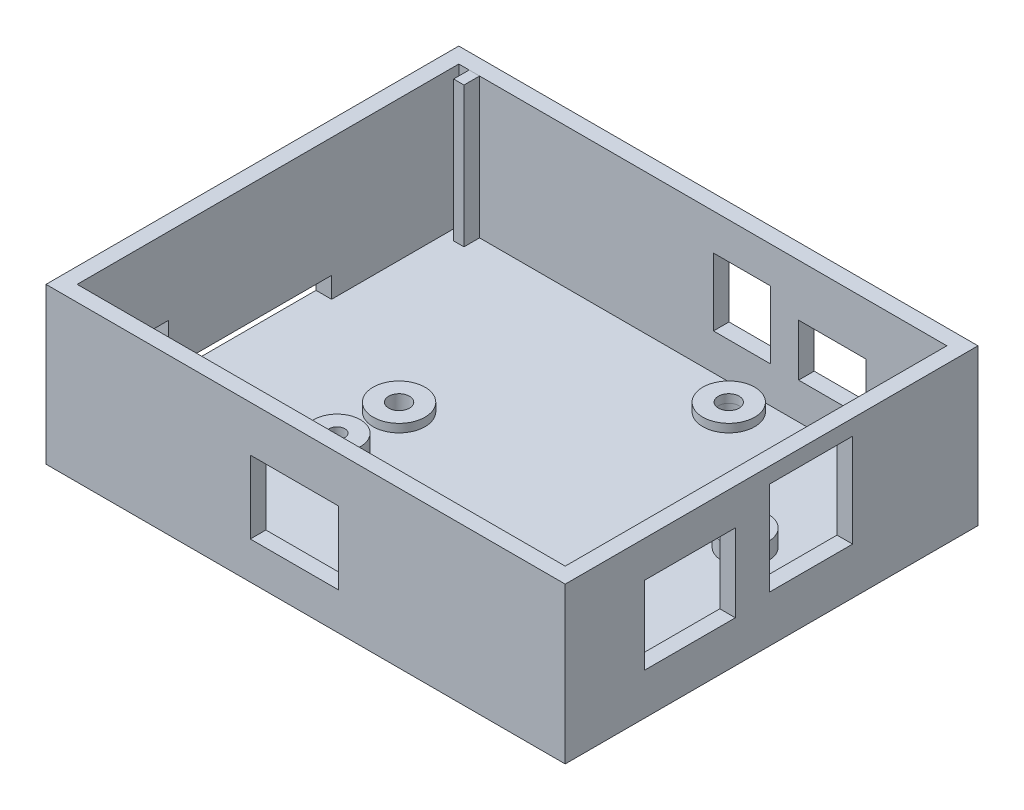
from build123d import *

# Parameters (mm, degrees)
SKETCH4_W             = 100
SKETCH4_H             = 79.5
BOSS_EXTRUDE3_DEPTH   = 30
SKETCH5_W             = 94
SKETCH5_H             = 73.5
CUT_EXTRUDE1_DEPTH    = 27
SKETCH9_R             = 5
BOSS_EXTRUDE5_DEPTH   = 1.6
BOSS_EXTRUDE5_2_DEPTH = 1.6
SKETCH10_R            = 2
CUT_EXTRUDE2_DEPTH    = 131.251333966
SKETCH11_R            = 2
CUT_EXTRUDE3_DEPTH    = 131.251333966
SKETCH12_R            = 4.5
BOSS_EXTRUDE6_DEPTH   = 3.2
SKETCH13_R            = 1.5
CUT_EXTRUDE4_DEPTH    = 130.948797609
SKETCH14_R            = 1.5
CUT_EXTRUDE5_DEPTH    = 130.948797609
SKETCH15_W            = 2
SKETCH15_H            = 3
BOSS_EXTRUDE7_DEPTH   = 27
SKETCH17_W            = 28
SKETCH17_H            = 4
CUT_EXTRUDE8_DEPTH    = 22.2
SKETCH18_W            = 8
SKETCH18_H            = 8
CUT_EXTRUDE9_DEPTH    = 22.2
SKETCH19_W            = 17
SKETCH19_H            = 14
CUT_EXTRUDE11_DEPTH   = 22.2
SKETCH20_R            = 5
BOSS_EXTRUDE8_DEPTH   = 1.6
SKETCH21_R            = 2
CUT_EXTRUDE12_DEPTH   = 131.251333966
SKETCH23_W            = 13
SKETCH23_H            = 10
SKETCH23_W_2          = 11
SKETCH23_H_2          = 13
CUT_EXTRUDE13_DEPTH   = 130.430483272
SKETCH24_W            = 16
SKETCH24_H            = 18
SKETCH24_W_2          = 17.520597446
SKETCH24_H_2          = 15
CUT_EXTRUDE15_DEPTH   = 129.954449322


with BuildPart() as part:
    # Sketch4 → Boss-Extrude3 (new body)
    with BuildSketch(Plane(origin=(0, 0, 0), x_dir=(1, 0, 0), z_dir=(0, 1, 0))):
        with Locations((50, 39.75)):
            Rectangle(SKETCH4_W, SKETCH4_H)
    extrude(amount=BOSS_EXTRUDE3_DEPTH)

    # Sketch5 → Cut-Extrude1 (cut)
    with BuildSketch(Plane(origin=(0, 30, 0), x_dir=(1, 0, 0), z_dir=(0, 1, 0))):
        with Locations((50, 39.75)):
            Rectangle(SKETCH5_W, SKETCH5_H)
    extrude(amount=-CUT_EXTRUDE1_DEPTH, mode=Mode.SUBTRACT)


with BuildPart() as body_2:
    # Sketch9 → Boss-Extrude5 (new body)
    with BuildSketch(Plane(origin=(0, 3, 0), x_dir=(1, 0, 0), z_dir=(0, 1, 0))):
        with Locations(Location((60, 8, 0), (0, 0, 270))):
            Circle(SKETCH9_R)
    extrude(amount=BOSS_EXTRUDE5_DEPTH)


with BuildPart() as body_3:
    # Sketch9 → Boss-Extrude5 2 (new body)
    with BuildSketch(Plane(origin=(0, 3, 0), x_dir=(1, 0, 0), z_dir=(0, 1, 0))):
        with Locations(Location((60, 71.5, 0), (0, 0, 270))):
            Circle(SKETCH9_R)
    extrude(amount=BOSS_EXTRUDE5_2_DEPTH)


with BuildPart() as cut_extrude2_tool:
    # Sketch10 → Cut-Extrude2 (new, through all)
    with BuildSketch(Plane(origin=(0, 4.6, 0), x_dir=(1, 0, 0), z_dir=(0, 1, 0))):
        with Locations(Location((60, 71.5, 0), (0, 0, 270))):
            Circle(SKETCH10_R)
    extrude(amount=-CUT_EXTRUDE2_DEPTH)


with BuildPart() as part_1:
    add(part.part)

    # Cut-Extrude2: cut by cut_extrude2_tool
    add(cut_extrude2_tool.part, mode=Mode.SUBTRACT)


with BuildPart() as body_3_1:
    add(body_3.part)

    # Cut-Extrude2: cut by cut_extrude2_tool
    add(cut_extrude2_tool.part, mode=Mode.SUBTRACT)


with BuildPart() as cut_extrude3_tool:
    # Sketch11 → Cut-Extrude3 (new, through all)
    with BuildSketch(Plane(origin=(0, 4.6, 0), x_dir=(1, 0, 0), z_dir=(0, 1, 0))):
        with Locations(Location((60, 8, 0), (0, 0, 270))):
            Circle(SKETCH11_R)
    extrude(amount=-CUT_EXTRUDE3_DEPTH)


with BuildPart() as part_2:
    add(part_1.part)

    # Cut-Extrude3: cut by cut_extrude3_tool
    add(cut_extrude3_tool.part, mode=Mode.SUBTRACT)

    # Sketch12 → Boss-Extrude6 (add)
    with BuildSketch(Plane(origin=(0, 3, 0), x_dir=(1, 0, 0), z_dir=(0, 1, 0))):
        with Locations(Location((29.05, 27, 0), (0, 0, 270))):
            Circle(SKETCH12_R)
        with Locations(Location((84.15, 50.5, 0), (0, 0, 270))):
            Circle(SKETCH12_R)
    extrude(amount=BOSS_EXTRUDE6_DEPTH)

    # Sketch13 → Cut-Extrude4 (cut, through all)
    with BuildSketch(Plane(origin=(0, 6.2, 0), x_dir=(1, 0, 0), z_dir=(0, 1, 0))):
        with Locations(Location((29.05, 27, 0), (0, 0, 270))):
            Circle(SKETCH13_R)
    extrude(amount=-CUT_EXTRUDE4_DEPTH, mode=Mode.SUBTRACT)

    # Sketch14 → Cut-Extrude5 (cut, through all)
    with BuildSketch(Plane(origin=(0, 6.2, 0), x_dir=(1, 0, 0), z_dir=(0, 1, 0))):
        with Locations(Location((84.15, 50.5, 0), (0, 0, 270))):
            Circle(SKETCH14_R)
    extrude(amount=-CUT_EXTRUDE5_DEPTH, mode=Mode.SUBTRACT)

    # Sketch17 → Cut-Extrude8 (cut)
    with BuildSketch(Plane(origin=(3, 0, 0), x_dir=(0, 0, -1), z_dir=(1, 0, 0))):
        with Locations((38, 5)):
            Rectangle(SKETCH17_W, SKETCH17_H)
    extrude(amount=-CUT_EXTRUDE8_DEPTH, mode=Mode.SUBTRACT)

    # Sketch18 → Cut-Extrude9 (cut)
    with BuildSketch(Plane(origin=(3, 0, 0), x_dir=(0, 0, -1), z_dir=(1, 0, 0))):
        with Locations((16.55, 11.2)):
            Rectangle(SKETCH18_W, SKETCH18_H)
    extrude(amount=-CUT_EXTRUDE9_DEPTH, mode=Mode.SUBTRACT)

    # Sketch19 → Cut-Extrude11 (cut)
    with BuildSketch(Plane(origin=(0, 0, -3), x_dir=(-1, 0, 0), z_dir=(0, 0, -1))):
        with Locations((-47.85, 14.2)):
            Rectangle(SKETCH19_W, SKETCH19_H)
    extrude(amount=-CUT_EXTRUDE11_DEPTH, mode=Mode.SUBTRACT)

    # Sketch20 → Boss-Extrude8 (add)
    with BuildSketch(Plane(origin=(0, 3, 0), x_dir=(1, 0, 0), z_dir=(0, 1, 0))):
        with Locations(Location((28.251811075, 39.75, 0), (0, 0, 270))):
            Circle(SKETCH20_R)
    extrude(amount=BOSS_EXTRUDE8_DEPTH)

    # Sketch21 → Cut-Extrude12 (cut, through all)
    with BuildSketch(Plane(origin=(0, 4.6, 0), x_dir=(1, 0, 0), z_dir=(0, 1, 0))):
        with Locations(Location((28.251811075, 39.75, 0), (0, 0, 270))):
            Circle(SKETCH21_R)
    extrude(amount=-CUT_EXTRUDE12_DEPTH, mode=Mode.SUBTRACT)

    # Sketch23 → Cut-Extrude13 (cut, through all)
    with BuildSketch(Plane.XY.offset(-76.5)):
        with Locations((74.95, 15)):
            Rectangle(SKETCH23_W, SKETCH23_H)
        with Locations((57.55, 16.5)):
            Rectangle(SKETCH23_W_2, SKETCH23_H_2)
    extrude(amount=-CUT_EXTRUDE13_DEPTH, mode=Mode.SUBTRACT)

    # Sketch24 → Cut-Extrude15 (cut, through all)
    with BuildSketch(Plane.ZY.offset(-97)):
        with Locations((-47.347833479, 18)):
            Rectangle(SKETCH24_W, SKETCH24_H)
        with Locations((-24.00690671, 15.5)):
            Rectangle(SKETCH24_W_2, SKETCH24_H_2)
    extrude(amount=-CUT_EXTRUDE15_DEPTH, mode=Mode.SUBTRACT)


with BuildPart() as body_2_1:
    add(body_2.part)

    # Cut-Extrude3: cut by cut_extrude3_tool
    add(cut_extrude3_tool.part, mode=Mode.SUBTRACT)


with BuildPart() as body_4:
    # Sketch15 → Boss-Extrude7 (new body)
    with BuildSketch(Plane(origin=(0, 3, 0), x_dir=(1, 0, 0), z_dir=(0, 1, 0))):
        with Locations((6, 75)):
            Rectangle(SKETCH15_W, SKETCH15_H)
    extrude(amount=BOSS_EXTRUDE7_DEPTH)


solid = Compound([body_3_1.part, part_2.part, body_2_1.part, body_4.part])
